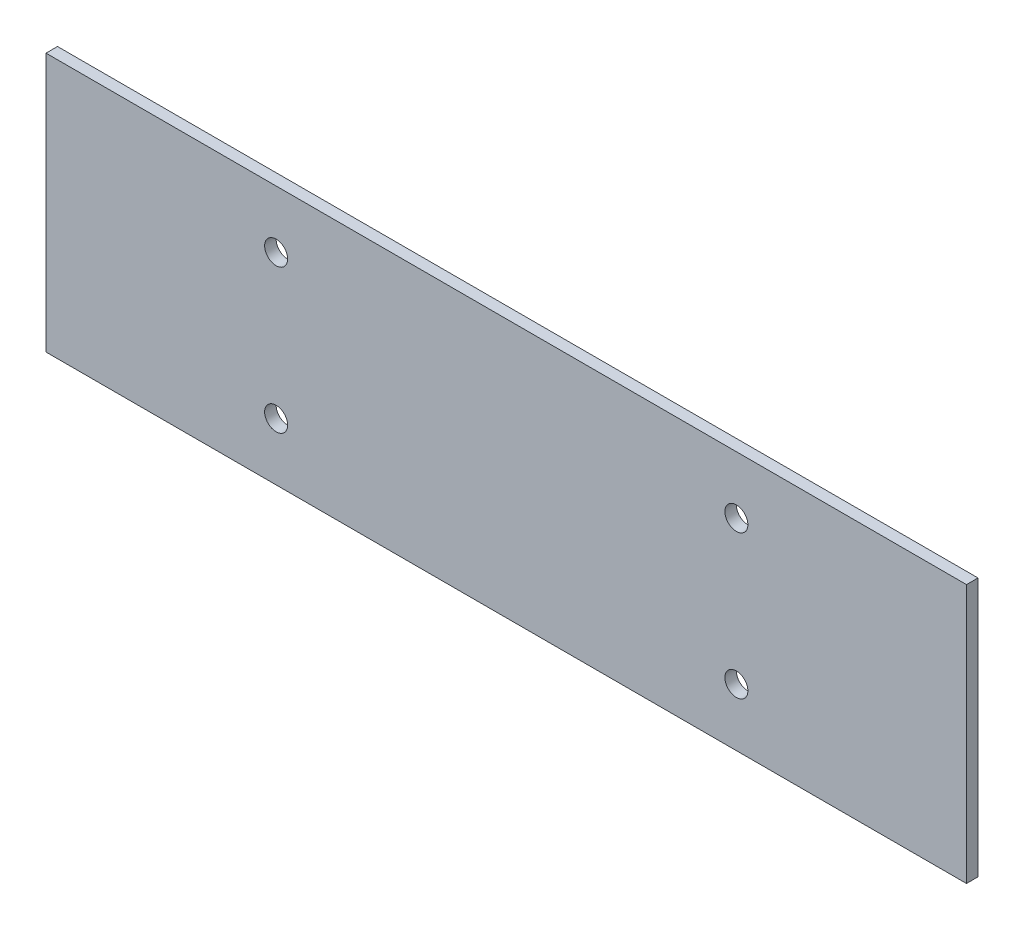
from build123d import *

# Parameters (mm, degrees)
IZIM1_W                     = 160
IZIM1_H                     = 45
IZIM1_R                     = 2
Y_KSEKLIK_EKSTR_ZYON1_DEPTH = 2


with BuildPart() as part:
    # Çizim1 → Yükseklik-Ekstrüzyon1 (new body)
    with BuildSketch(Plane.XY):
        with Locations((80, 22.5)):
            Rectangle(IZIM1_W, IZIM1_H)
        with Locations((40, 35)):
            Circle(IZIM1_R, mode=Mode.SUBTRACT)
        with Locations((120, 35)):
            Circle(IZIM1_R, mode=Mode.SUBTRACT)
        with Locations((40, 10)):
            Circle(IZIM1_R, mode=Mode.SUBTRACT)
        with Locations((120, 10)):
            Circle(IZIM1_R, mode=Mode.SUBTRACT)
    extrude(amount=Y_KSEKLIK_EKSTR_ZYON1_DEPTH)


solid = part.part
